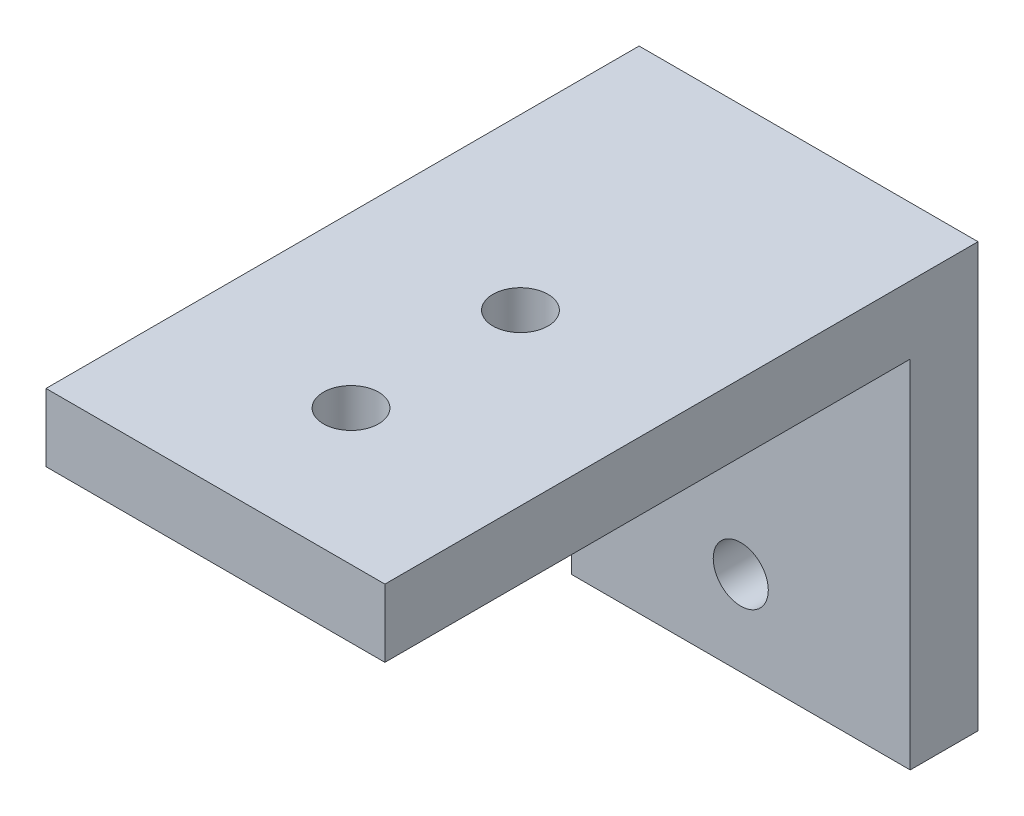
from build123d import *

# Parameters (mm, degrees)
SKETCH_1_W          = 40
SKETCH_1_H          = 50
EXTRUDE_1_DEPTH     = 8
SKETCH_2_W          = 40
SKETCH_2_H          = 8
EXTRUDE_2_DEPTH     = 70
SKETCH_3_R          = 3.25
CUT_EXTRUDE_1_DEPTH = 9
SKETCH_4_R          = 3.25
CUT_EXTRUDE_2_DEPTH = 8


with BuildPart() as part:
    # 草图1 → 凸台-拉伸1 (new body)
    with BuildSketch(Plane.XY):
        with Locations((0, -25)):
            Rectangle(SKETCH_1_W, SKETCH_1_H)
    extrude(amount=EXTRUDE_1_DEPTH)

    # 草图2 → 凸台-拉伸2 (add)
    with BuildSketch(Plane.XY):
        with Locations((0, -4)):
            Rectangle(SKETCH_2_W, SKETCH_2_H)
    extrude(amount=EXTRUDE_2_DEPTH)

    # 草图3 → 切除-拉伸1 (cut)
    with BuildSketch(Plane(origin=(0, 0, 0), x_dir=(-1, 0, 0), z_dir=(0, 0, -1))):
        with Locations((0, -20)):
            Circle(SKETCH_3_R)
        with Locations((0, -40)):
            Circle(SKETCH_3_R)
    extrude(amount=-CUT_EXTRUDE_1_DEPTH, mode=Mode.SUBTRACT)

    # 草图4 → 切除-拉伸2 (cut)
    with BuildSketch(Plane.XZ.offset(8)):
        with Locations(Location((0, 34, 0), (0, 0, 270))):
            Circle(SKETCH_4_R)
        with Locations(Location((0, 54, 0), (0, 0, 270))):
            Circle(SKETCH_4_R)
    extrude(amount=-CUT_EXTRUDE_2_DEPTH, mode=Mode.SUBTRACT)


solid = part.part
